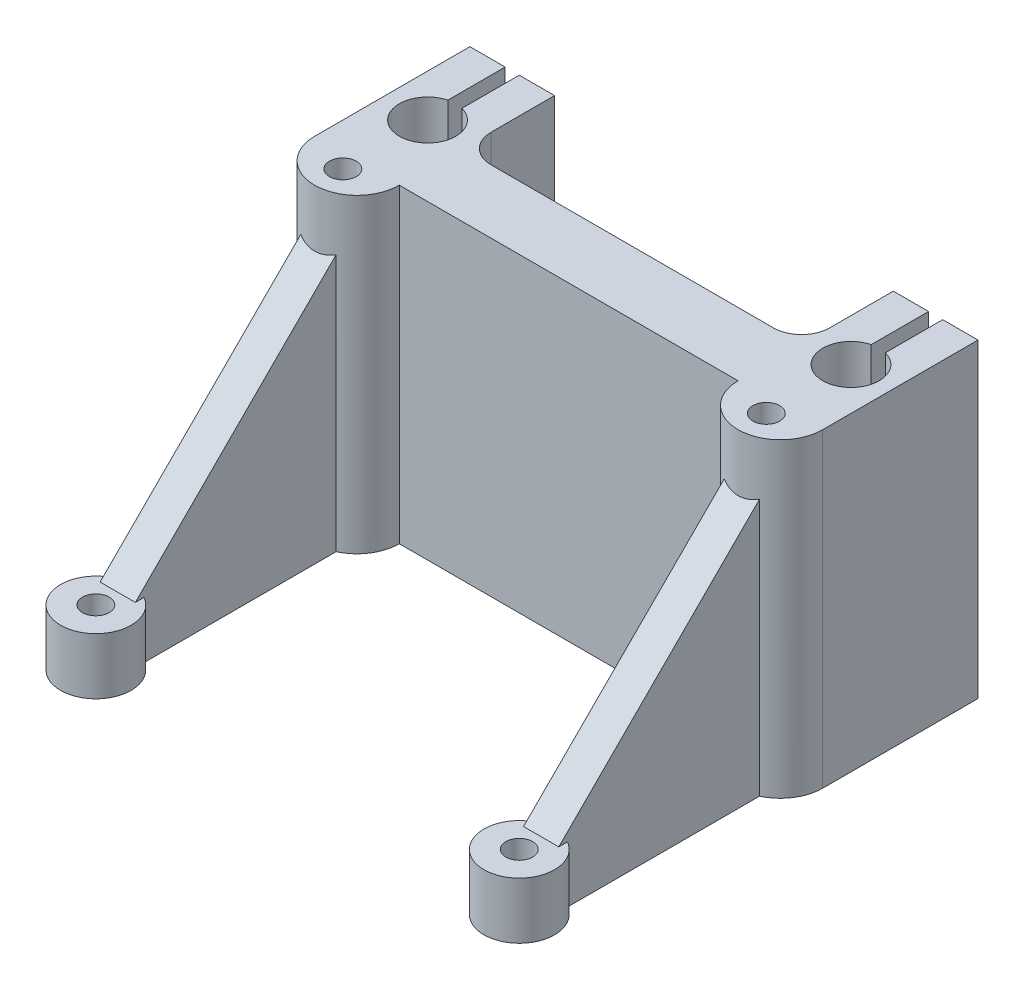
from build123d import *

# Parameters (mm, degrees)
BOSS_EXTRUDE1_DEPTH   = 44
SKETCH3_R             = 4
SKETCH3_R_2           = 1.9
CUT_EXTRUDE1_DEPTH    = 60.059292241
SKETCH4_W             = 2
SKETCH4_H             = 12
CUT_EXTRUDE2_DEPTH    = 60.059292241
SKETCH5_W             = 48
SKETCH5_H             = 13
CUT_EXTRUDE3_DEPTH    = 60.059292241
FILLET1_R             = 4
BOSS_EXTRUDE5_DEPTH   = 2.5
SKETCH6_R             = 5
BOSS_EXTRUDE2_DEPTH   = 8
BOSS_EXTRUDE2_2_DEPTH = 8
SKETCH7_R             = 1.9
CUT_EXTRUDE5_DEPTH    = 73.773621595


with BuildPart() as part:
    # Sketch1 → Boss-Extrude1 (new body)
    with BuildSketch(Plane(origin=(0, 0, 0), x_dir=(1, 0, 0), z_dir=(0, 1, 0))):
        with BuildLine():
            Line((-24, -10), (24, -10))
            ThreePointArc((24, -10), (30, -16), (36, -10))
            Line((36, -10), (36, 12))
            Line((36, 12), (-36, 12))
            Line((-36, 12), (-36, -10))
            ThreePointArc((-36, -10), (-30, -16), (-24, -10))
        make_face()
    extrude(amount=BOSS_EXTRUDE1_DEPTH)

    # Sketch3 → Cut-Extrude1 (cut, through all)
    with BuildSketch(Plane(origin=(0, 44, 0), x_dir=(1, 0, 0), z_dir=(0, 1, 0))):
        with Locations(Location((-30, 0, 0), (0, 0, 270))):
            Circle(SKETCH3_R)
        with Locations(Location((-30, -12, 0), (0, 0, 270))):
            Circle(SKETCH3_R_2)
    cut_extrude1 = extrude(amount=-CUT_EXTRUDE1_DEPTH, mode=Mode.SUBTRACT)

    # Sketch4 → Cut-Extrude2 (cut, through all)
    with BuildSketch(Plane(origin=(0, 44, 0), x_dir=(1, 0, 0), z_dir=(0, 1, 0))):
        with Locations((-30, 6)):
            Rectangle(SKETCH4_W, SKETCH4_H)
    cut_extrude2 = extrude(amount=-CUT_EXTRUDE2_DEPTH, mode=Mode.SUBTRACT)

    # Mirror1: Cut-Extrude1, Cut-Extrude2 across plane
    add(cut_extrude1.mirror(Plane(origin=(0, 0, 0), x_dir=(0, 0, 1), z_dir=(1, 0, 0))), mode=Mode.SUBTRACT)
    add(cut_extrude2.mirror(Plane(origin=(0, 0, 0), x_dir=(0, 0, 1), z_dir=(1, 0, 0))), mode=Mode.SUBTRACT)

    # Sketch5 → Cut-Extrude3 (cut, through all)
    with BuildSketch(Plane(origin=(0, 44, 0), x_dir=(1, 0, 0), z_dir=(0, 1, 0))):
        with Locations((0, 5.5)):
            Rectangle(SKETCH5_W, SKETCH5_H)
    extrude(amount=-CUT_EXTRUDE3_DEPTH, mode=Mode.SUBTRACT)

    # Fillet1
    fillet1_edges = [part.edges().sort_by_distance(p)[0] for p in [
        (24, 22, 1),
        (-24, 22, 1),
    ]]
    fillet(fillet1_edges, radius=FILLET1_R)

    # Sketch8 → Boss-Extrude5 (add, symmetric)
    with BuildSketch(Plane.ZY.offset(30)):
        Polygon((43.9, 0), (13.9, 0), (13.9, 38), (43.9, 8), align=None)
    boss_extrude5 = extrude(amount=BOSS_EXTRUDE5_DEPTH, both=True)

    # Mirror7: Boss-Extrude5 across plane
    add(boss_extrude5.mirror(Plane(origin=(0, 0, 0), x_dir=(0, 0, 1), z_dir=(1, 0, 0))))


with BuildPart() as body_2:
    # Sketch6 → Boss-Extrude2 (new body)
    with BuildSketch(Plane(origin=(0, 0, 0), x_dir=(1, 0, 0), z_dir=(0, 1, 0))):
        with Locations(Location((-30, -47, 0), (0, 0, 270))):
            Circle(SKETCH6_R)
    extrude(amount=BOSS_EXTRUDE2_DEPTH)


with BuildPart() as body_3:
    # Sketch6 → Boss-Extrude2 2 (new body)
    with BuildSketch(Plane(origin=(0, 0, 0), x_dir=(1, 0, 0), z_dir=(0, 1, 0))):
        with Locations(Location((30, -47, 0), (0, 0, 90))):
            Circle(SKETCH6_R)
    extrude(amount=BOSS_EXTRUDE2_2_DEPTH)


with BuildPart() as cut_extrude5_tool:
    # Sketch7 → Cut-Extrude5 (new, through all)
    with BuildSketch(Plane(origin=(0, 8, 0), x_dir=(1, 0, 0), z_dir=(0, 1, 0))):
        with Locations(Location((-30, -47, 0), (0, 0, 270))):
            Circle(SKETCH7_R)
        with Locations(Location((30, -47, 0), (0, 0, 90))):
            Circle(SKETCH7_R)
    extrude(amount=-CUT_EXTRUDE5_DEPTH)


with BuildPart() as body_2_1:
    add(body_2.part)

    # Cut-Extrude5: cut by cut_extrude5_tool
    add(cut_extrude5_tool.part, mode=Mode.SUBTRACT)


with BuildPart() as body_3_1:
    add(body_3.part)

    # Cut-Extrude5: cut by cut_extrude5_tool
    add(cut_extrude5_tool.part, mode=Mode.SUBTRACT)


solid = Compound([part.part, body_2_1.part, body_3_1.part])
